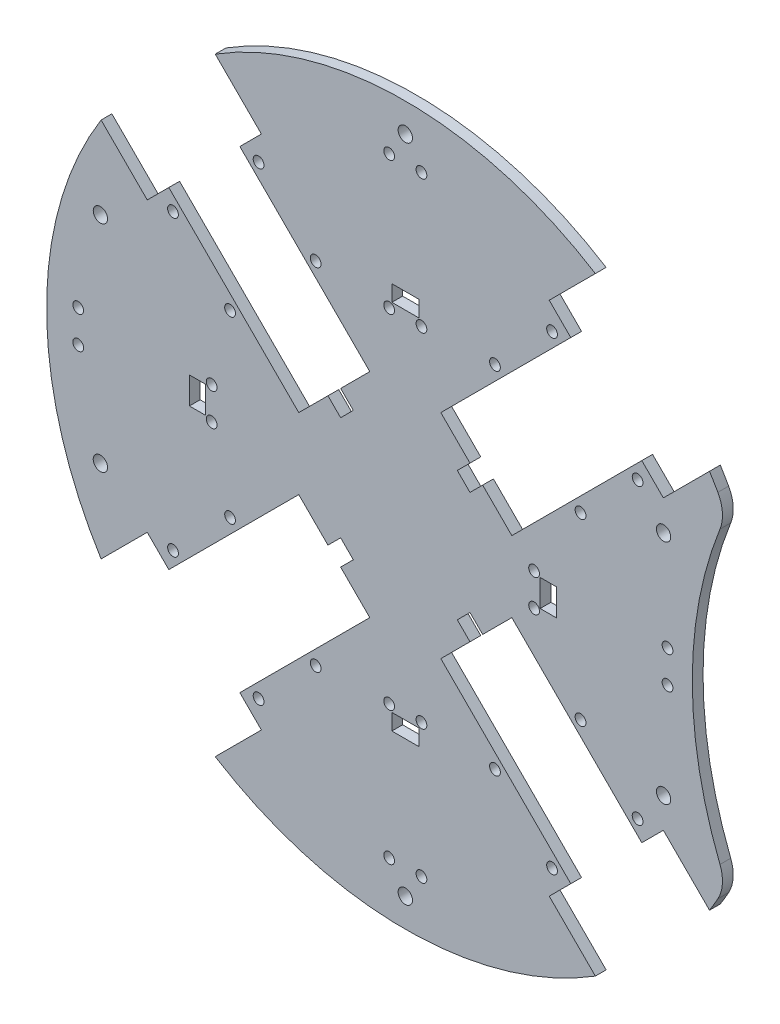
from build123d import *

# Parameters (mm, degrees)
CROQUIS1_R              = 100
SALIENTE_EXTRUIR1_DEPTH = 3
CROQUIS3_R              = 110
CORTAR_EXTRUIR1_DEPTH   = 3
REDONDEO1_R             = 10
CORTAR_EXTRUIR2_DEPTH   = 10
CORTAR_EXTRUIR3_DEPTH   = 10
CROQUIS8_R              = 1.5
CROQUIS8_R_2            = 1.502317269
CROQUIS8_R_3            = 2
CORTAR_EXTRUIR4_DEPTH   = 10
CROQUIS9_R              = 1.5
CROQUIS9_W              = 4.5
CROQUIS9_H              = 7.5
CROQUIS9_W_2            = 7.5
CROQUIS9_H_2            = 4.5
CORTAR_EXTRUIR5_DEPTH   = 10


with BuildPart() as part:
    # Croquis1 → Saliente-Extruir1 (new body)
    with BuildSketch(Plane.XY):
        Circle(CROQUIS1_R)
    extrude(amount=SALIENTE_EXTRUIR1_DEPTH)

    # Croquis3 → Cortar-Extruir1 (cut)
    with BuildSketch(Plane.XY.offset(3)):
        with Locations((190, 0)):
            Circle(CROQUIS3_R)
    extrude(amount=-CORTAR_EXTRUIR1_DEPTH, mode=Mode.SUBTRACT)

    # Redondeo1
    redondeo1_edges = [part.edges().sort_by_distance(p)[0] for p in [
        (89.473684211, -44.659375654, 1.5),
        (89.473684211, 44.659375654, 1.5),
    ]]
    fillet(redondeo1_edges, radius=REDONDEO1_R)

    # Croquis5 → Cortar-Extruir2 (cut)
    with BuildSketch(Plane.XY.offset(3)):
        Polygon((-29.69848481, -9.899494937), (-9.899494937, -29.69848481), (-64.346717088, -84.145706961), (-84.145706961, -64.346717088), align=None)
        Polygon((-9.899494937, 29.69848481), (-29.69848481, 9.899494937), (-84.145706961, 64.346717088), (-64.346717088, 84.145706961), align=None)
        Polygon((29.69848481, 9.899494937), (9.899494937, 29.69848481), (64.346717088, 84.145706961), (84.145706961, 64.346717088), align=None)
        Polygon((9.899494937, -29.69848481), (29.69848481, -9.899494937), (84.145706961, -64.346717088), (64.346717088, -84.145706961), align=None)
    extrude(amount=-CORTAR_EXTRUIR2_DEPTH, mode=Mode.SUBTRACT)

    # Croquis7 → Cortar-Extruir3 (cut)
    with BuildSketch(Plane.XY.offset(3)):
        Polygon((-71.939339828, -40.119534675), (-40.119534675, -71.939339828), (-57.090097423, -88.909902577), (-88.909902577, -57.090097423), align=None)
        Polygon((-40.119534675, 71.939339828), (-71.939339828, 40.119534675), (-88.909902577, 57.090097423), (-57.090097423, 88.909902577), align=None)
        Polygon((71.939339828, 40.119534675), (40.119534675, 71.939339828), (57.090097423, 88.909902577), (88.909902577, 57.090097423), align=None)
        Polygon((40.119534675, -71.939339828), (71.939339828, -40.119534675), (88.909902577, -57.090097423), (57.090097423, -88.909902577), align=None)
        Polygon((-21.566756826, -18.03122292), (-18.03122292, -21.566756826), (-14.495689014, -18.03122292), (-18.03122292, -14.495689014), align=None)
        Polygon((-21.566756826, 18.03122292), (-18.03122292, 14.495689014), (-14.495689014, 18.03122292), (-18.03122292, 21.566756826), align=None)
        Polygon((18.03122292, 21.566756826), (14.495689014, 18.03122292), (18.03122292, 14.495689014), (21.566756826, 18.03122292), align=None)
        Polygon((21.566756826, -18.03122292), (18.03122292, -14.495689014), (14.495689014, -18.03122292), (18.03122292, -21.566756826), align=None)
    extrude(amount=-CORTAR_EXTRUIR3_DEPTH, mode=Mode.SUBTRACT)

    # Croquis8 → Cortar-Extruir4 (cut)
    with BuildSketch(Plane.XY.offset(3)):
        with Locations((-64.762205999, 40.904423202)):
            Circle(CROQUIS8_R)
        with Locations((-48.852303422, 24.994520625)):
            Circle(CROQUIS8_R_2)
        with Locations((-24.994520625, 48.852303422)):
            Circle(CROQUIS8_R)
        with Locations((-40.904423202, 64.762205999)):
            Circle(CROQUIS8_R)
        with Locations((64.762205999, 40.904423202)):
            Circle(CROQUIS8_R)
        with Locations((48.852303422, 24.994520625)):
            Circle(CROQUIS8_R)
        with Locations((24.994520625, 48.852303422)):
            Circle(CROQUIS8_R_2)
        with Locations((40.904423202, 64.762205999)):
            Circle(CROQUIS8_R)
        with Locations((40.904423202, -64.762205999)):
            Circle(CROQUIS8_R)
        with Locations((24.994520625, -48.852303422)):
            Circle(CROQUIS8_R)
        with Locations((48.852303422, -24.994520625)):
            Circle(CROQUIS8_R_2)
        with Locations((64.762205999, -40.904423202)):
            Circle(CROQUIS8_R)
        with Locations((-64.762205999, -40.904423202)):
            Circle(CROQUIS8_R)
        with Locations((-48.852303422, -24.994520625)):
            Circle(CROQUIS8_R)
        with Locations((-24.994520625, -48.852303422)):
            Circle(CROQUIS8_R_2)
        with Locations((-40.904423202, -64.762205999)):
            Circle(CROQUIS8_R)
        with Locations((0, 92)):
            Circle(CROQUIS8_R_3)
        with Locations((0, -92)):
            Circle(CROQUIS8_R_3)
        with Locations((72, 31.694913472)):
            Circle(CROQUIS8_R_3)
        with Locations((72, -31.694913472)):
            Circle(CROQUIS8_R_3)
        with Locations((-85, -30)):
            Circle(CROQUIS8_R_3)
        with Locations((-85, 30)):
            Circle(CROQUIS8_R_3)
    extrude(amount=-CORTAR_EXTRUIR4_DEPTH, mode=Mode.SUBTRACT)

    # Croquis9 → Cortar-Extruir5 (cut)
    with BuildSketch(Plane.XY.offset(3)):
        with Locations((73.1, -4.5)):
            Circle(CROQUIS9_R)
        with Locations((35.9, 4.5)):
            Circle(CROQUIS9_R)
        with Locations((73.1, 4.5)):
            Circle(CROQUIS9_R)
        with Locations((35.9, -4.5)):
            Circle(CROQUIS9_R)
        with Locations((-91.190074744, 4.5)):
            Circle(CROQUIS9_R)
        with Locations((-91.190074744, -4.5)):
            Circle(CROQUIS9_R)
        with Locations((-53.990074744, 4.5)):
            Circle(CROQUIS9_R)
        with Locations((-53.990074744, -4.5)):
            Circle(CROQUIS9_R)
        with Locations((-4.5, 85)):
            Circle(CROQUIS9_R)
        with Locations((4.5, 85)):
            Circle(CROQUIS9_R)
        with Locations((-4.5, 47.8)):
            Circle(CROQUIS9_R)
        with Locations((4.5, 47.8)):
            Circle(CROQUIS9_R)
        with Locations((-4.5, -47.8)):
            Circle(CROQUIS9_R)
        with Locations((4.5, -47.8)):
            Circle(CROQUIS9_R)
        with Locations((4.5, -85)):
            Circle(CROQUIS9_R)
        with Locations((-4.5, -85)):
            Circle(CROQUIS9_R)
        with Locations((39.85, 0)):
            Rectangle(CROQUIS9_W, CROQUIS9_H)
        with Locations((0, -51.75)):
            Rectangle(CROQUIS9_W_2, CROQUIS9_H_2)
        with Locations((-57.940074744, 0)):
            Rectangle(CROQUIS9_W, CROQUIS9_H)
        with Locations((0, 51.75)):
            Rectangle(CROQUIS9_W_2, CROQUIS9_H_2)
    extrude(amount=-CORTAR_EXTRUIR5_DEPTH, mode=Mode.SUBTRACT)


solid = part.part
